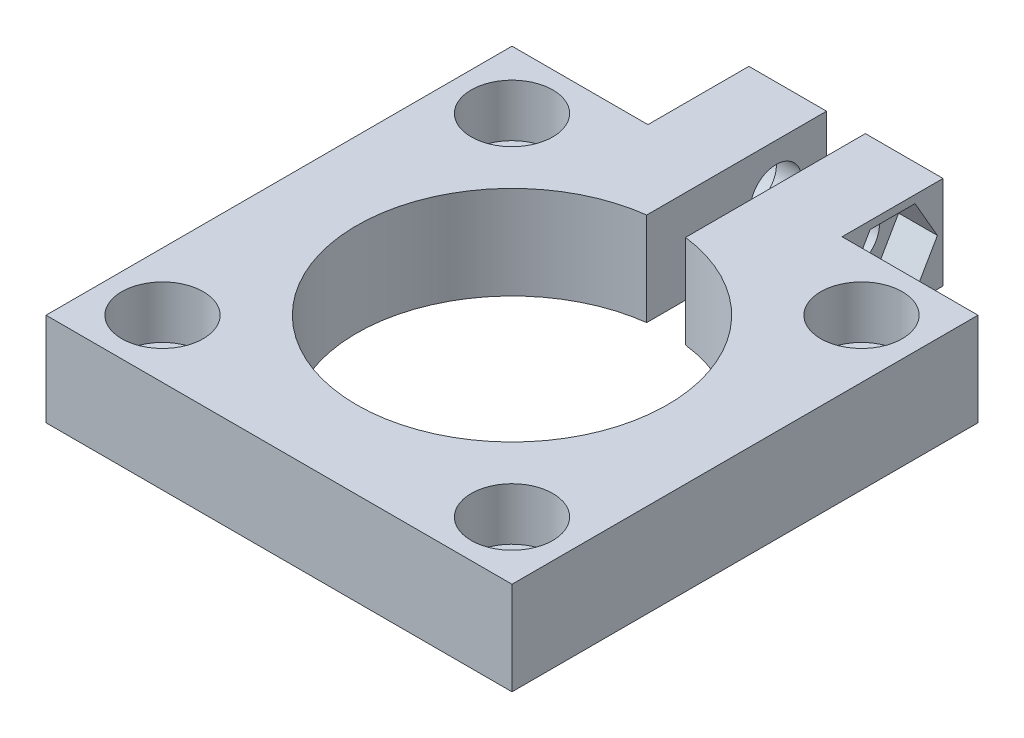
from build123d import *

# Parameters (mm, degrees)
SKETCH1_W                                           = 60
SKETCH1_H                                           = 60
BOSS_EXTRUDE1_DEPTH                                 = 12
SKETCH3_R                                           = 20
CUT_EXTRUDE1_DEPTH                                  = 12
SKETCH4_W                                           = 5
SKETCH4_H                                           = 25
CUT_EXTRUDE2_DEPTH                                  = 12
SKETCH5_W                                           = 10
SKETCH5_H                                           = 13
BOSS_EXTRUDE4_DEPTH                                 = 12
LPATTERN1_COUNT                                     = 2
LPATTERN1_PITCH                                     = 15
CBORE_FOR_M6_HEX_SOCKET_HEAD_CAP_SCREW1_D           = 6.6
CBORE_FOR_M6_HEX_SOCKET_HEAD_CAP_SCREW1_CBORE_D     = 10.5
CBORE_FOR_M6_HEX_SOCKET_HEAD_CAP_SCREW1_CBORE_DEPTH = 6.75
CUT_EXTRUDE3_DEPTH                                  = 4.990153475
CBORE_FOR_M6_HEX_SOCKET_HEAD_CAP_SCREW2_D           = 7.5
CBORE_FOR_M6_HEX_SOCKET_HEAD_CAP_SCREW2_CBORE_D     = 10.5
CBORE_FOR_M6_HEX_SOCKET_HEAD_CAP_SCREW2_CBORE_DEPTH = 6.75
CBORE_FOR_M6_HEX_SOCKET_HEAD_CAP_SCREW3_D           = 7.5
CBORE_FOR_M6_HEX_SOCKET_HEAD_CAP_SCREW3_CBORE_D     = 10.5
CBORE_FOR_M6_HEX_SOCKET_HEAD_CAP_SCREW3_CBORE_DEPTH = 6.75
CBORE_FOR_M6_HEX_SOCKET_HEAD_CAP_SCREW4_D           = 7.5
CBORE_FOR_M6_HEX_SOCKET_HEAD_CAP_SCREW4_CBORE_D     = 10.5
CBORE_FOR_M6_HEX_SOCKET_HEAD_CAP_SCREW4_CBORE_DEPTH = 6.75
CBORE_FOR_M6_HEX_SOCKET_HEAD_CAP_SCREW5_D           = 7.5
CBORE_FOR_M6_HEX_SOCKET_HEAD_CAP_SCREW5_CBORE_D     = 10.5
CBORE_FOR_M6_HEX_SOCKET_HEAD_CAP_SCREW5_CBORE_DEPTH = 6.75


with BuildPart() as part:
    # Sketch1 → Boss-Extrude1 (new body)
    with BuildSketch(Plane(origin=(0, 0, 0), x_dir=(1, 0, 0), z_dir=(0, 1, 0))):
        Rectangle(SKETCH1_W, SKETCH1_H)
    extrude(amount=BOSS_EXTRUDE1_DEPTH)

    # Sketch3 → Cut-Extrude1 (cut)
    with BuildSketch(Plane(origin=(0, 12, 0), x_dir=(-1, 0, 0), z_dir=(0, 1, 0))):
        with Locations(Location((0, 0, 0), (0, 0, 90))):
            Circle(SKETCH3_R)
    extrude(amount=-CUT_EXTRUDE1_DEPTH, mode=Mode.SUBTRACT)

    # Sketch4 → Cut-Extrude2 (cut)
    with BuildSketch(Plane(origin=(0, 12, 0), x_dir=(-1, 0, 0), z_dir=(0, 1, 0))):
        with Locations((0, -30)):
            Rectangle(SKETCH4_W, SKETCH4_H)
    extrude(amount=-CUT_EXTRUDE2_DEPTH, mode=Mode.SUBTRACT)

    # Sketch5 → Boss-Extrude4 (add)
    with BuildSketch(Plane(origin=(0, 12, 0), x_dir=(-1, 0, 0), z_dir=(0, 1, 0))):
        with Locations((7.5, -36.5)):
            Rectangle(SKETCH5_W, SKETCH5_H)
    boss_extrude4 = extrude(amount=-BOSS_EXTRUDE4_DEPTH)

    # LPattern1: Boss-Extrude4 ×2
    with Locations(*[(i * LPATTERN1_PITCH, 0, 0) for i in range(1, LPATTERN1_COUNT)]):
        add(boss_extrude4)

    # CBORE for M6 Hex Socket Head Cap Screw1 (through all)
    with Locations(Plane.ZY.offset(12.5)):
        with Locations((-36.5, 6)):
            CounterBoreHole(CBORE_FOR_M6_HEX_SOCKET_HEAD_CAP_SCREW1_D / 2, CBORE_FOR_M6_HEX_SOCKET_HEAD_CAP_SCREW1_CBORE_D / 2, CBORE_FOR_M6_HEX_SOCKET_HEAD_CAP_SCREW1_CBORE_DEPTH)

    # Sketch9 → Cut-Extrude3 (cut)
    with BuildSketch(Plane(origin=(12.5, 0, 0), x_dir=(0, 0, -1), z_dir=(1, 0, 0))):
        Polygon((42.273502692, 6), (39.386751346, 11), (33.613248654, 11), (30.726497308, 6), (33.613248654, 1), (39.386751346, 1), align=None)
    extrude(amount=-CUT_EXTRUDE3_DEPTH, mode=Mode.SUBTRACT)

    # CBORE for M6 Hex Socket Head Cap Screw2 (through all)
    with Locations(Plane(origin=(0, 12, 0), x_dir=(-1, 0, 0), z_dir=(0, 1, 0))):
        with Locations((22.5, -22.5)):
            CounterBoreHole(CBORE_FOR_M6_HEX_SOCKET_HEAD_CAP_SCREW2_D / 2, CBORE_FOR_M6_HEX_SOCKET_HEAD_CAP_SCREW2_CBORE_D / 2, CBORE_FOR_M6_HEX_SOCKET_HEAD_CAP_SCREW2_CBORE_DEPTH)

    # CBORE for M6 Hex Socket Head Cap Screw3 (through all)
    with Locations(Plane(origin=(0, 12, 0), x_dir=(-1, 0, 0), z_dir=(0, 1, 0))):
        with Locations((-22.5, -22.5)):
            CounterBoreHole(CBORE_FOR_M6_HEX_SOCKET_HEAD_CAP_SCREW3_D / 2, CBORE_FOR_M6_HEX_SOCKET_HEAD_CAP_SCREW3_CBORE_D / 2, CBORE_FOR_M6_HEX_SOCKET_HEAD_CAP_SCREW3_CBORE_DEPTH)

    # CBORE for M6 Hex Socket Head Cap Screw4 (through all)
    with Locations(Plane(origin=(0, 12, 0), x_dir=(-1, 0, 0), z_dir=(0, 1, 0))):
        with Locations((-22.5, 22.5)):
            CounterBoreHole(CBORE_FOR_M6_HEX_SOCKET_HEAD_CAP_SCREW4_D / 2, CBORE_FOR_M6_HEX_SOCKET_HEAD_CAP_SCREW4_CBORE_D / 2, CBORE_FOR_M6_HEX_SOCKET_HEAD_CAP_SCREW4_CBORE_DEPTH)

    # CBORE for M6 Hex Socket Head Cap Screw5 (through all)
    with Locations(Plane(origin=(0, 12, 0), x_dir=(-1, 0, 0), z_dir=(0, 1, 0))):
        with Locations((22.5, 22.5)):
            CounterBoreHole(CBORE_FOR_M6_HEX_SOCKET_HEAD_CAP_SCREW5_D / 2, CBORE_FOR_M6_HEX_SOCKET_HEAD_CAP_SCREW5_CBORE_D / 2, CBORE_FOR_M6_HEX_SOCKET_HEAD_CAP_SCREW5_CBORE_DEPTH)


solid = part.part
